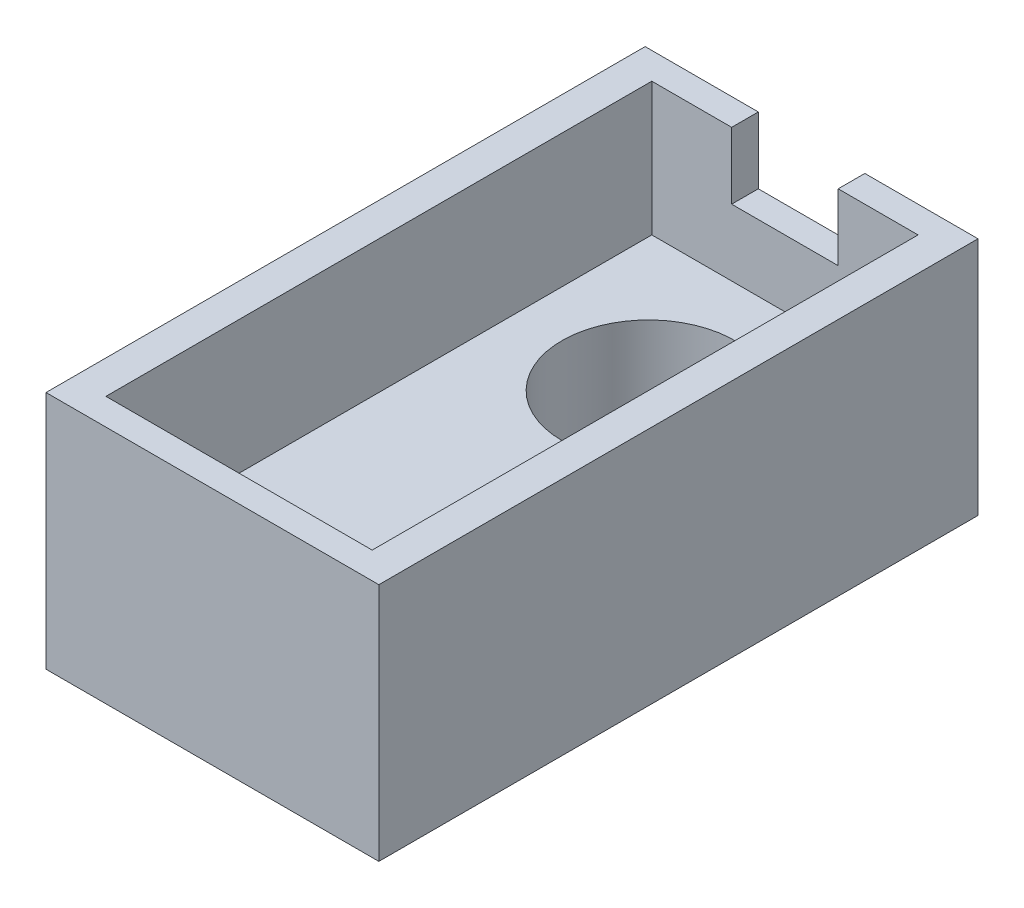
from build123d import *

# Parameters (mm, degrees)
SKETCH1_W          = 25
SKETCH1_H          = 45
BASE_DEPTH         = 13
SKETCH2_W          = 20
SKETCH2_H          = 41
SEAT_DEPTH         = 5
SKETCH3_R          = 1.5
SCREWHOLE_DEPTH    = 8
SKETCH4_R          = 6.5
SCREWINSET_DEPTH   = 7
SEATSECURITY_DEPTH = 5


with BuildPart() as part:
    # Sketch1 → Base (new body)
    with BuildSketch(Plane(origin=(0, 0, 0), x_dir=(1, 0, 0), z_dir=(0, 1, 0))):
        with Locations((12.5, 22.5)):
            Rectangle(SKETCH1_W, SKETCH1_H)
    extrude(amount=BASE_DEPTH)

    # Sketch2 → Seat (cut)
    with BuildSketch(Plane(origin=(0, 13, 0), x_dir=(1, 0, 0), z_dir=(0, 1, 0))):
        with Locations((12.5, 22.5)):
            Rectangle(SKETCH2_W, SKETCH2_H)
    extrude(amount=-SEAT_DEPTH, mode=Mode.SUBTRACT)

    # Sketch3 → ScrewHole (cut)
    with BuildSketch(Plane(origin=(0, 8, 0), x_dir=(1, 0, 0), z_dir=(0, 1, 0))):
        with Locations(Location((12.5, 32.75, 0), (0, 0, 270))):
            Circle(SKETCH3_R)
    extrude(amount=-SCREWHOLE_DEPTH, mode=Mode.SUBTRACT)

    # Sketch4 → ScrewInset (cut)
    with BuildSketch(Plane(origin=(0, 8, 0), x_dir=(1, 0, 0), z_dir=(0, 1, 0))):
        with Locations(Location((12.5, 32.75, 0), (0, 0, 270))):
            Circle(SKETCH4_R)
    extrude(amount=-SCREWINSET_DEPTH, mode=Mode.SUBTRACT)

    # Sketch6 → SeatSecurity (add)
    with BuildSketch(Plane(origin=(0, 13, 0), x_dir=(1, 0, 0), z_dir=(0, 1, 0))):
        Polygon((2.5, 2), (2.5, 43), (8.5, 43), (8.5, 45), (0, 45), (0, 0), (25, 0), (25, 45), (16.5, 45), (16.5, 43), (22.5, 43), (22.5, 2), align=None)
    extrude(amount=SEATSECURITY_DEPTH)


solid = part.part
